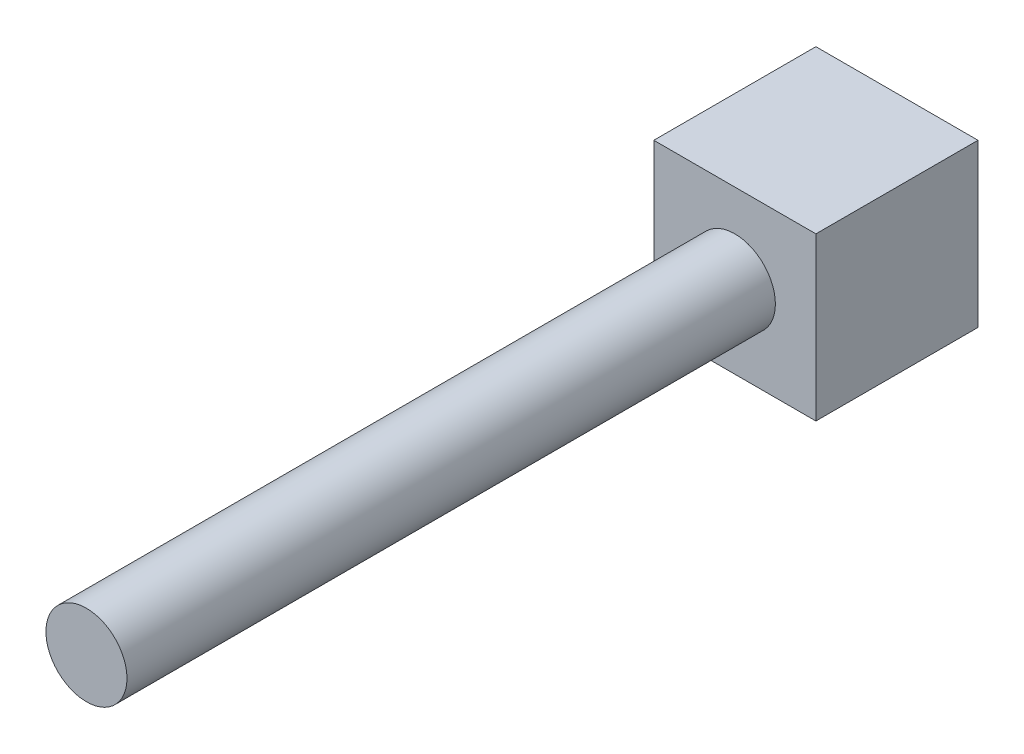
from build123d import *

# Parameters (mm, degrees)
SKETCH_1_W      = 10
SKETCH_1_H      = 10
EXTRUDE_1_DEPTH = 10
SKETCH_2_R      = 2.5
EXTRUDE_2_DEPTH = 40


with BuildPart() as part:
    # 草图1 → 凸台-拉伸1 (new body)
    with BuildSketch(Plane.XY):
        Rectangle(SKETCH_1_W, SKETCH_1_H)
    extrude(amount=EXTRUDE_1_DEPTH)

    # 草图2 → 凸台-拉伸2 (add)
    with BuildSketch(Plane.XY.offset(10)):
        Circle(SKETCH_2_R)
    extrude(amount=EXTRUDE_2_DEPTH)


solid = part.part
